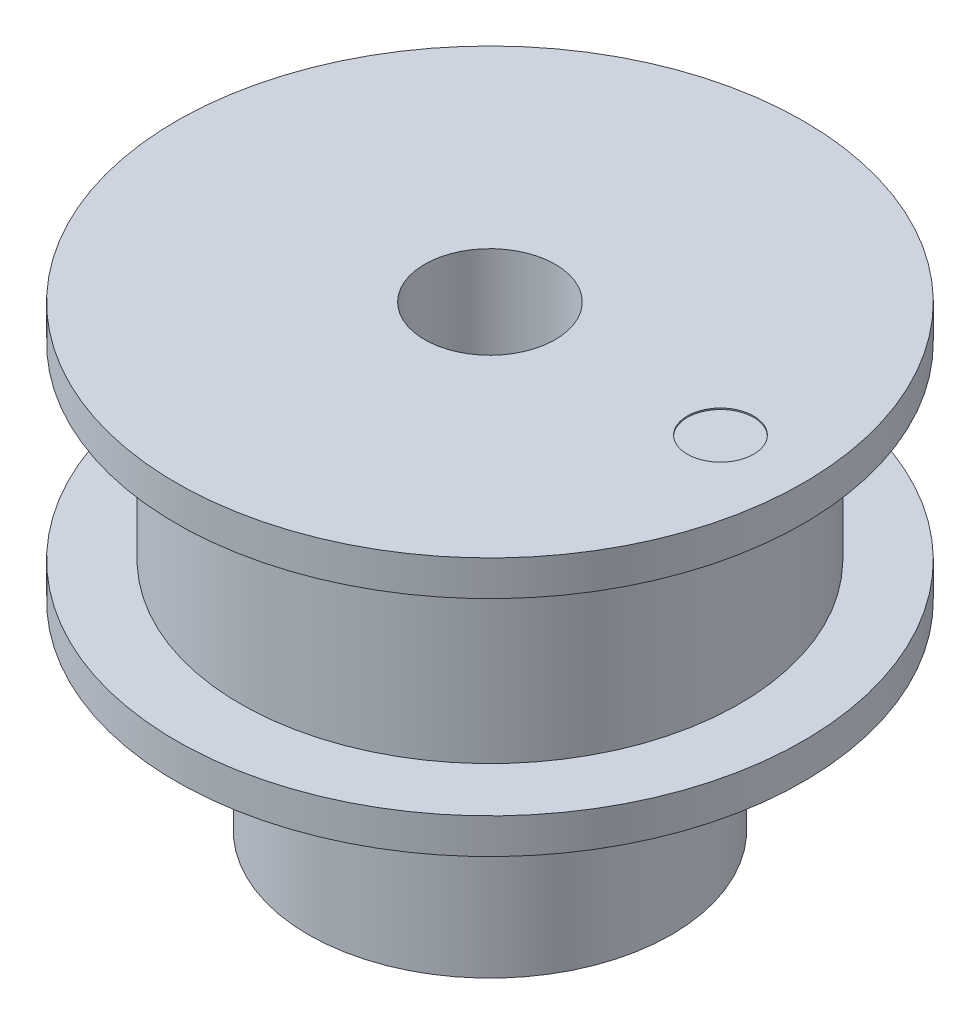
from build123d import *

# Parameters (mm, degrees)
SKETCH2_R          = 1.27
CUT_EXTRUDE1_DEPTH = 0.0508


with BuildPart() as part:
    # Sketch1 → Revolve1 (revolve)
    with BuildSketch(Plane.XY, mode=Mode.PRIVATE) as revolve1_sk:
        Polygon((2.5, 0), (2.5, 17.5), (12, 17.5), (12, 16.15), (9.55, 16.15), (9.55, 8.95), (12, 8.95), (12, 7.6), (6.95, 7.6), (6.95, 0), align=None)
    revolve(revolve1_sk.sketch.rotate(Axis((0, 0, 0), (0, 1, 0)), 90), axis=Axis((0, 0, 0), (0, 1, 0)))

    # Sketch2 → Cut-Extrude1 (cut)
    with BuildSketch(Plane(origin=(0, 17.5, 0), x_dir=(1, 0, 0), z_dir=(0, 1, 0))):
        with Locations(Location((8.825, 0, 0), (0, 0, 270))):
            Circle(SKETCH2_R)
    extrude(amount=-CUT_EXTRUDE1_DEPTH, mode=Mode.SUBTRACT)


solid = part.part
